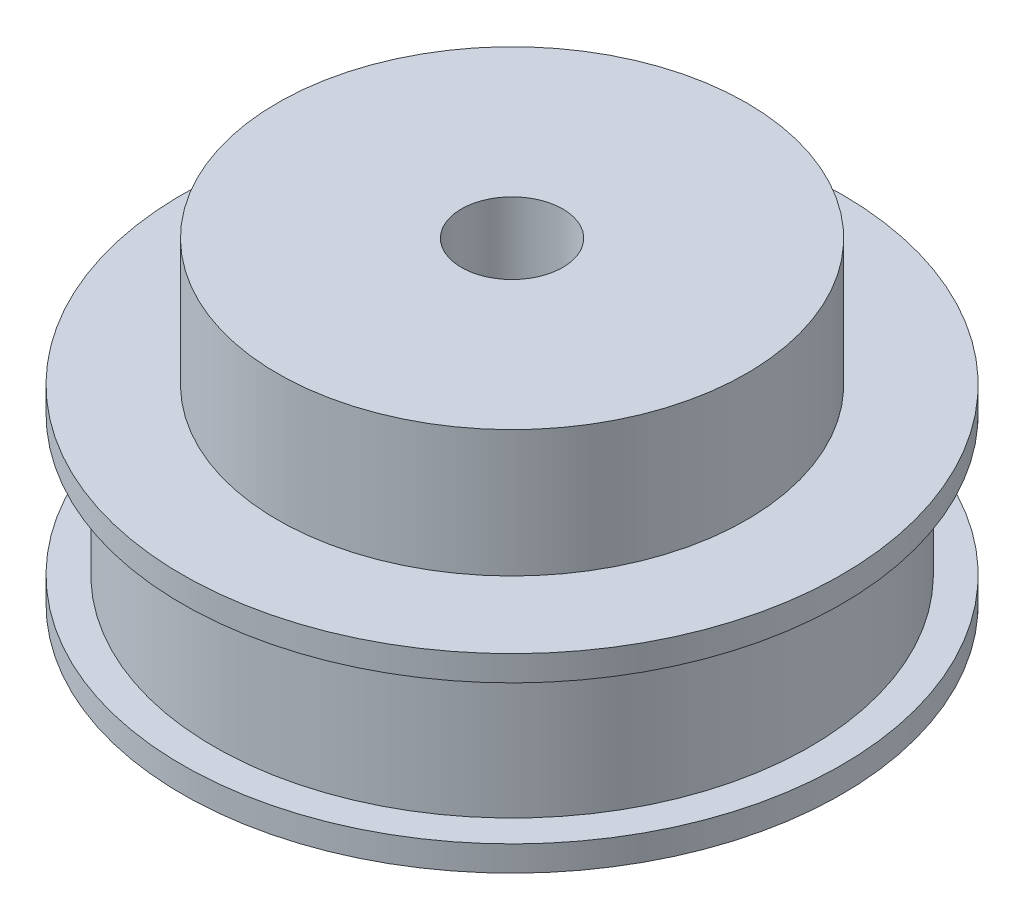
from build123d import *


with BuildPart() as part:
    # 草图2 → 旋转1 (revolve)
    with BuildSketch(Plane.XY, mode=Mode.PRIVATE) as revolve_1_sk:
        Polygon((4, 11.674224209), (4, -13.325775791), (26, -13.325775791), (26, -11.325775791), (23.5, -11.325775791), (23.5, -0.325775791), (26, -0.325775791), (26, 1.674224209), (18.5, 1.674224209), (18.5, 11.674224209), align=None)
    revolve(revolve_1_sk.sketch.rotate(Axis((0, 0, 0), (0, 1, 0)), 90), axis=Axis((0, 0, 0), (0, 1, 0)))


solid = part.part
